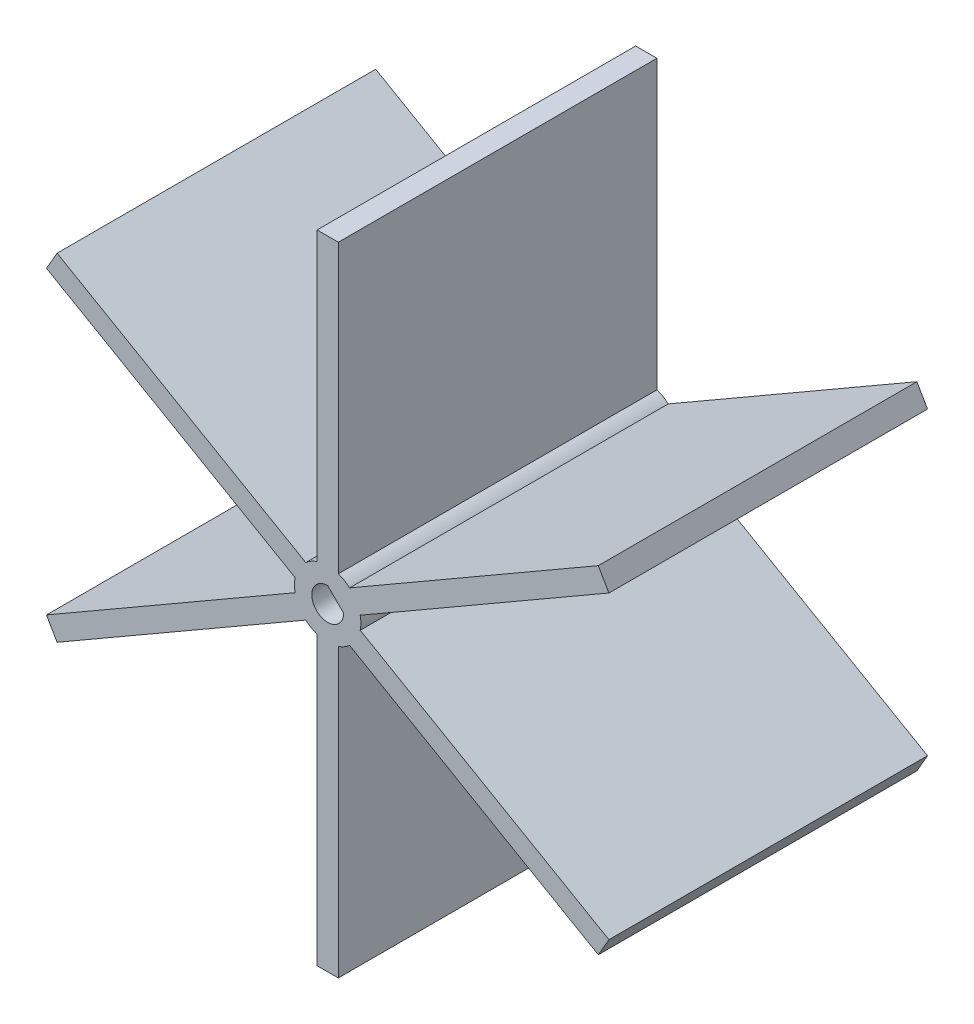
from build123d import *

# Parameters (mm, degrees)
SKETCH1_R               = 7.9375
BOSS_EXTRUDE1_DEPTH     = 76.2
CUT_EXTRUDE1_DEPTH      = 128.031257511
CUT_EXTRUDE1_DEPTH_BACK = 128.031257511


with BuildPart() as part:
    # Sketch1 → Boss-Extrude1 (new body)
    with BuildSketch(Plane.XY):
        Circle(SKETCH1_R)
        Polygon((2.54, 0), (2.54, 76.2), (-2.54, 76.2), (-2.54, 0), (-2.54, -76.2), (2.54, -76.2), align=None)
        Polygon((1.27, -2.199704526), (67.261135768, 35.900295474), (64.721135768, 40.299704526), (-1.27, 2.199704526), (-67.261135768, -35.900295474), (-64.721135768, -40.299704526), align=None)
        Polygon((-1.27, -2.199704526), (64.721135768, -40.299704526), (67.261135768, -35.900295474), (1.27, 2.199704526), (-64.721135768, 40.299704526), (-67.261135768, 35.900295474), align=None)
    extrude(amount=BOSS_EXTRUDE1_DEPTH)

    # Sketch2 → Cut-Extrude1 (cut, two sides: drawn at the far end of the back side and taken through both)
    with BuildSketch(Plane.XY.offset(76.2).offset(-CUT_EXTRUDE1_DEPTH_BACK)):
        with BuildLine():
            Line((3.81, 0), (0, 3.81))
            ThreePointArc((0, 3.81), (-2.694076836, -2.694076836), (3.81, 0))
        make_face()
    extrude(amount=CUT_EXTRUDE1_DEPTH + CUT_EXTRUDE1_DEPTH_BACK, mode=Mode.SUBTRACT)


solid = part.part
